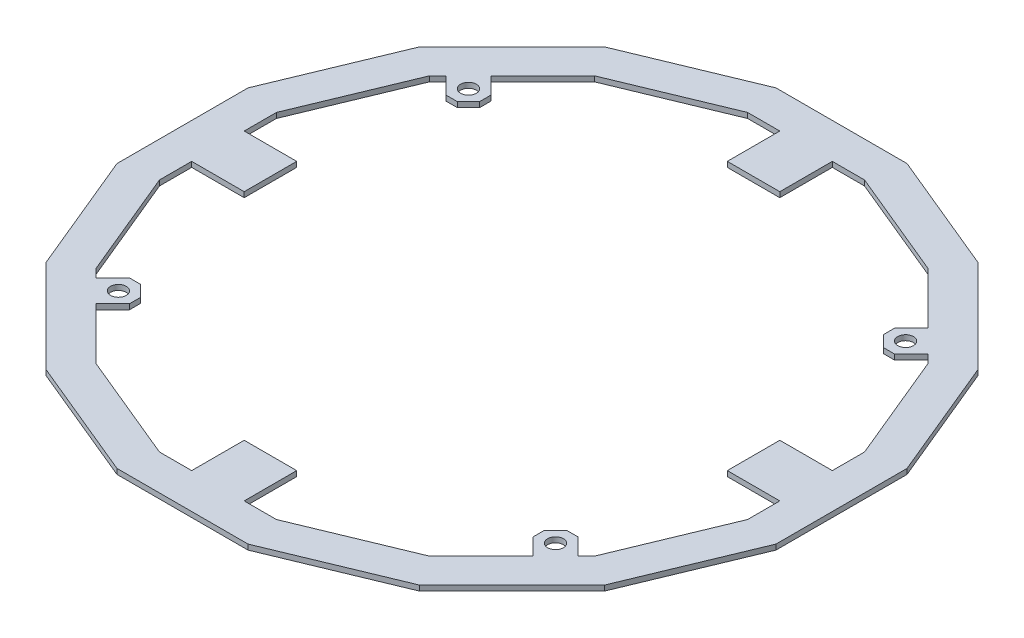
from build123d import *

# Parameters (mm, degrees)
BOSS_EXTRUDE1_DEPTH = 1
SKETCH2_W           = 10
SKETCH2_H           = 10
BOSS_EXTRUDE2_DEPTH = 1
SKETCH3_R           = 1.5
BOSS_EXTRUDE3_DEPTH = 1
CHAMFER1_SIZE       = 1.5


with BuildPart() as part:
    # Sketch1 → Boss-Extrude1 (new body)
    with BuildSketch(Plane(origin=(0, 0, 0), x_dir=(1, 0, 0), z_dir=(0, 1, 0))):
        Polygon((62.75, -12.481751053), (62.75, 12.481751053), (53.19688133, 35.545019709), (35.545019709, 53.19688133), (12.481751053, 62.75), (-12.481751053, 62.75), (-35.545019709, 53.19688133), (-53.19688133, 35.545019709), (-62.75, 12.481751053), (-62.75, -12.481751053), (-53.19688133, -35.545019709), (-35.545019709, -53.19688133), (-12.481751053, -62.75), (12.481751053, -62.75), (35.545019709, -53.19688133), (53.19688133, -35.545019709), align=None)
        Polygon((56, -11.139092573), (56, 11.139092573), (47.474507641, 31.721451852), (31.721451852, 47.474507641), (11.139092573, 56), (-11.139092573, 56), (-31.721451852, 47.474507641), (-47.474507641, 31.721451852), (-56, 11.139092573), (-56, -11.139092573), (-47.474507641, -31.721451852), (-31.721451852, -47.474507641), (-11.139092573, -56), (11.139092573, -56), (31.721451852, -47.474507641), (47.474507641, -31.721451852), align=None, mode=Mode.SUBTRACT)
    extrude(amount=BOSS_EXTRUDE1_DEPTH)

    # Sketch2 → Boss-Extrude2 (add)
    with BuildSketch(Plane(origin=(0, 1, 0), x_dir=(1, 0, 0), z_dir=(0, 1, 0))):
        with Locations((0, 51)):
            Rectangle(SKETCH2_W, SKETCH2_H)
        with Locations((51, 0)):
            Rectangle(SKETCH2_W, SKETCH2_H)
        with Locations((0, -51)):
            Rectangle(SKETCH2_W, SKETCH2_H)
        with Locations((-51, 0)):
            Rectangle(SKETCH2_W, SKETCH2_H)
    extrude(amount=-BOSS_EXTRUDE2_DEPTH)

    # Sketch3 → Boss-Extrude3 (add)
    # profile 1 of 4: a face of its own
    with BuildSketch(Plane(origin=(0, 1, 0), x_dir=(1, 0, 0), z_dir=(0, 1, 0))):
        Polygon((-45.863587475, 33.332372018), (-41.620946788, 37.575012705), (-37.378306101, 33.332372018), (-41.620946788, 29.08973133), align=None)
        with Locations(Location((-41.620946788, 33.332372018, 0), (0, 0, 270))):
            Circle(SKETCH3_R, mode=Mode.SUBTRACT)
    # profile 2 of 4: a face of its own
    with BuildSketch(Plane(origin=(0, 1, 0), x_dir=(1, 0, 0), z_dir=(0, 1, 0))):
        Polygon((37.378306101, 33.332372018), (41.620946788, 29.08973133), (45.863587475, 33.332372018), (41.620946788, 37.575012705), align=None)
        with Locations(Location((41.620946788, 33.332372018, 0), (0, 0, 270))):
            Circle(SKETCH3_R, mode=Mode.SUBTRACT)
    # profile 3 of 4: a face of its own
    with BuildSketch(Plane(origin=(0, 1, 0), x_dir=(1, 0, 0), z_dir=(0, 1, 0))):
        Polygon((41.620946788, -37.575012705), (37.378306101, -33.332372018), (41.620946788, -29.08973133), (45.863587475, -33.332372018), align=None)
        with Locations(Location((41.620946788, -33.332372018, 0), (0, 0, 270))):
            Circle(SKETCH3_R, mode=Mode.SUBTRACT)
    # profile 4 of 4: a face of its own
    with BuildSketch(Plane(origin=(0, 1, 0), x_dir=(1, 0, 0), z_dir=(0, 1, 0))):
        Polygon((-37.378306101, -33.332372018), (-41.620946788, -29.08973133), (-45.863587475, -33.332372018), (-41.620946788, -37.575012705), align=None)
        with Locations(Location((-41.620946788, -33.332372018, 0), (0, 0, 270))):
            Circle(SKETCH3_R, mode=Mode.SUBTRACT)
    extrude(amount=-BOSS_EXTRUDE3_DEPTH)

    # Chamfer1
    chamfer1_edges = [part.edges().sort_by_distance(p)[0] for p in [
        (-37.378306101, 0.5, -33.332372018),
        (-41.620946788, 0.5, -29.08973133),
        (41.620946788, 0.5, -29.08973133),
        (37.378306101, 0.5, -33.332372018),
        (41.620946788, 0.5, 29.08973133),
        (37.378306101, 0.5, 33.332372018),
        (-41.620946788, 0.5, 29.08973133),
        (-37.378306101, 0.5, 33.332372018),
    ]]
    chamfer(chamfer1_edges, length=CHAMFER1_SIZE)


solid = part.part
